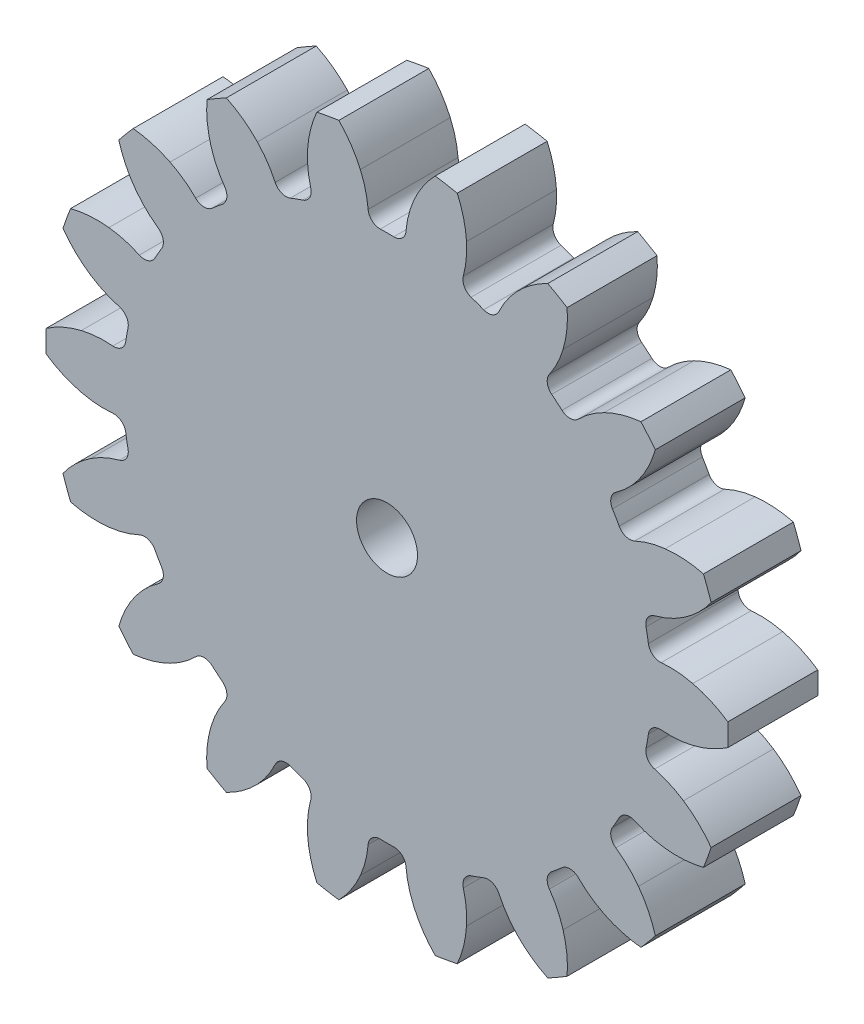
from build123d import *

# Parameters (mm, degrees)
SKETCH1_R        = 22.154444444
GEAR_BASE_DEPTH  = 2.921
GEAR_CUT_DEPTH   = 32.871112018
GEAR_TEETH_COUNT = 18
SKETCH5_R        = 1.9812
BORE_DEPTH       = 32.717000991


with BuildPart() as part:
    # Sketch1 → GEAR_BASE (new, symmetric)
    with BuildSketch(Plane.XY):
        Circle(SKETCH1_R)
    extrude(amount=GEAR_BASE_DEPTH, both=True)

    # Sketch2 → GEAR_CUT (cut, through all)
    with BuildSketch(Plane.XY.offset(2.921)):
        with BuildLine():
            ThreePointArc((-21.055369781, -6.891357779), (-21.817868653, -3.847078905), (-22.142558786, -0.725602538))
            ThreePointArc((-22.142558786, -0.725602538), (-21.048570622, -1.335897451), (-19.862913053, -1.740231611))
            ThreePointArc((-19.862913053, -1.740231611), (-18.845463736, -1.900787076), (-17.815453821, -1.892993071))
            ThreePointArc((-17.815453821, -1.892993071), (-17.266950012, -2.055614298), (-16.979260589, -2.550121009))
            ThreePointArc((-16.979260589, -2.550121009), (-16.908848206, -2.981486151), (-16.827478635, -3.410919246))
            ThreePointArc((-16.827478635, -3.410919246), (-16.928687007, -3.973999131), (-17.388492253, -4.314412449))
            ThreePointArc((-17.388492253, -4.314412449), (-18.359050676, -4.659372619), (-19.260227088, -5.158233566))
            ThreePointArc((-19.260227088, -5.158233566), (-20.236090329, -5.943702164), (-21.055369781, -6.891357779))
        make_face()
    gear_cut = extrude(amount=-GEAR_CUT_DEPTH, mode=Mode.SUBTRACT)

    # GEAR_TEETH: GEAR_CUT ×18 about axis
    gear_teeth_axis = Axis((0, 0, 50), (0, 0, -1))
    for i in range(1, GEAR_TEETH_COUNT):
        add(gear_cut.rotate(gear_teeth_axis, i * 360 / GEAR_TEETH_COUNT), mode=Mode.SUBTRACT)

    # Sketch5 → BORE (cut, through all)
    with BuildSketch(Plane(origin=(0, 0, 2.921), x_dir=(-1, 0, 0), z_dir=(0, 0, -1))):
        Circle(SKETCH5_R)
    extrude(amount=BORE_DEPTH, mode=Mode.SUBTRACT)


solid = part.part
